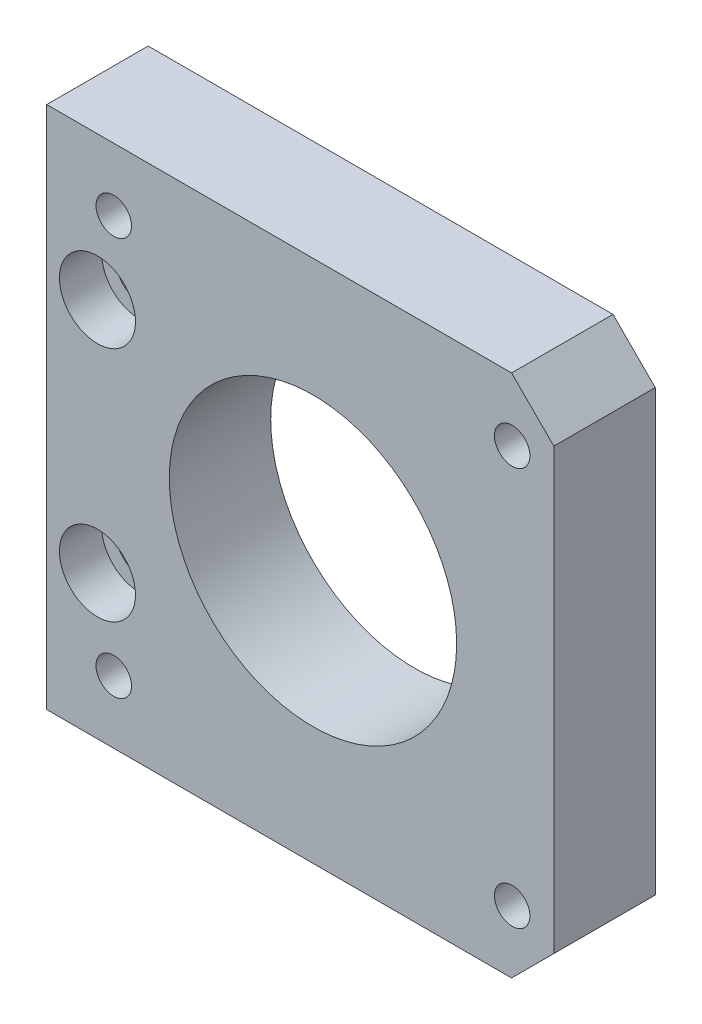
from build123d import *

# Parameters (mm, degrees)
SZKIC1_W                                             = 60
SZKIC1_H                                             = 62
DODANIE_WYCI_GNI_CIE1_DEPTH                          = 12
SZKIC2_R                                             = 17
WYTNIJ_WYCI_GNI_CIE1_DEPTH                           = 337.608080711
POG_BIENIE_WALCOWE_POD_M5_WKR_T_DO_CZ_CI_D           = 5.5
POG_BIENIE_WALCOWE_POD_M5_WKR_T_DO_CZ_CI_CBORE_D     = 9
POG_BIENIE_WALCOWE_POD_M5_WKR_T_DO_CZ_CI_CBORE_DEPTH = 5
OTW_R_GWINTOWANY_M5X0_81_D                           = 4.2
SFAZOWANIE1_SIZE                                     = 5


with BuildPart() as part:
    # Szkic1 → Dodanie-wyciągnięcie1 (new body)
    with BuildSketch(Plane.XY):
        with Locations((30, 300)):
            Rectangle(SZKIC1_W, SZKIC1_H)
    extrude(amount=DODANIE_WYCI_GNI_CIE1_DEPTH)

    # Szkic2 → Wytnij-wyciągnięcie1 (cut, through all)
    with BuildSketch(Plane.XY.offset(12)):
        with Locations((31.5, 300)):
            Circle(SZKIC2_R)
    extrude(amount=-WYTNIJ_WYCI_GNI_CIE1_DEPTH, mode=Mode.SUBTRACT)

    # Pogłębienie walcowe pod M5 Wkręt do części metalowych z łbem sześciokątnym1 (through all)
    with Locations(Plane.XY.offset(12)):
        with Locations((6, 314), (6, 286)):
            CounterBoreHole(POG_BIENIE_WALCOWE_POD_M5_WKR_T_DO_CZ_CI_D / 2, POG_BIENIE_WALCOWE_POD_M5_WKR_T_DO_CZ_CI_CBORE_D / 2, POG_BIENIE_WALCOWE_POD_M5_WKR_T_DO_CZ_CI_CBORE_DEPTH)

    # Otwór gwintowany M5x0.81 (through all)
    with Locations(Plane.XY.offset(12)):
        with Locations((55.07, 323.57), (55.07, 276.43), (7.93, 323.57), (7.93, 276.43)):
            Hole(OTW_R_GWINTOWANY_M5X0_81_D / 2)

    # Sfazowanie1
    sfazowanie1_edges = [part.edges().sort_by_distance(p)[0] for p in [
        (60, 331, 6),
        (60, 269, 6),
    ]]
    chamfer(sfazowanie1_edges, length=SFAZOWANIE1_SIZE)


solid = part.part
